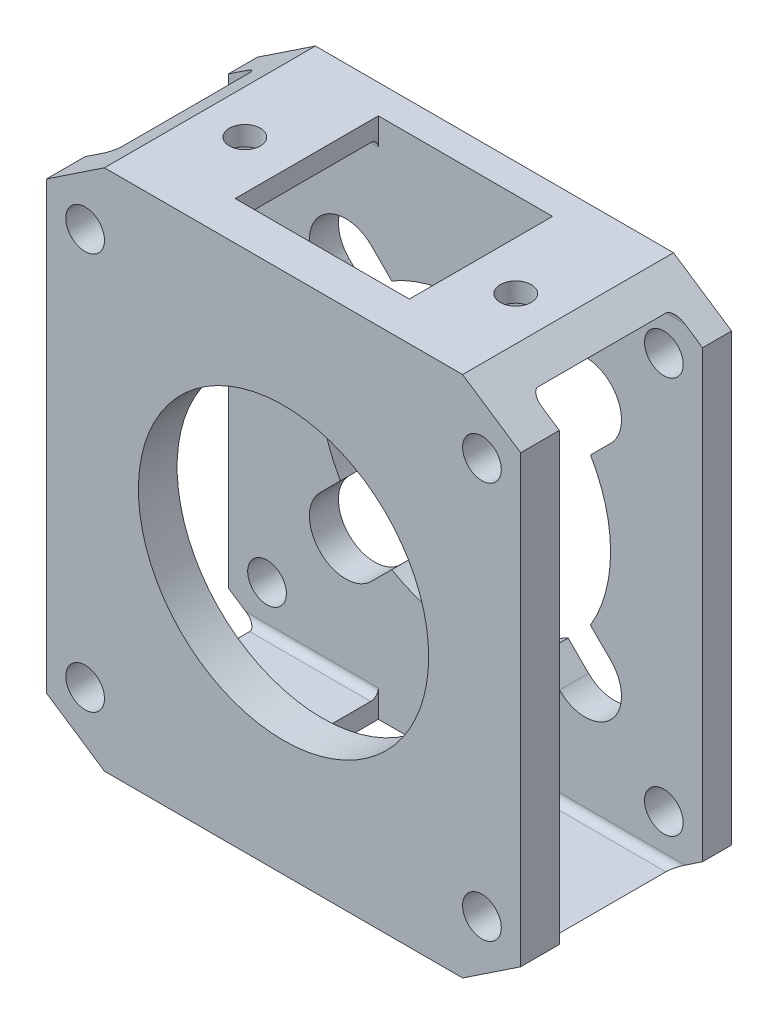
from build123d import *

# Parameters (mm, degrees)
SKETCH_1_R          = 15
SKETCH_1_R_2        = 2
EXTRUDE_1_DEPTH     = 21.8
SKETCH_2_W          = 14.8
SKETCH_2_H          = 50.012193308
CUT_EXTRUDE_1_DEPTH = 61.056343124
FILLET_1_R          = 0.8
SKETCH_3_R          = 1.6
CUT_EXTRUDE_2_DEPTH = 64.191026256
SKETCH_4_W          = 18
SKETCH_4_H          = 14.8
CUT_EXTRUDE_3_DEPTH = 64.191026256
CUT_EXTRUDE_4_DEPTH = 3


with BuildPart() as part:
    # 草图1 → 凸台-拉伸1 (new body)
    with BuildSketch(Plane.XY):
        Polygon((-24.506096654, 23.006096654), (-18.506096654, 27.006096654), (18.506096654, 27.006096654), (24.506096654, 23.006096654), (24.506096654, -23.006096654), (18.506096654, -27.006096654), (-18.506096654, -27.006096654), (-24.506096654, -23.006096654), align=None)
        Circle(SKETCH_1_R, mode=Mode.SUBTRACT)
        with Locations((-20.506096654, 20.506096654)):
            Circle(SKETCH_1_R_2, mode=Mode.SUBTRACT)
        with Locations((20.506096654, 20.506096654)):
            Circle(SKETCH_1_R_2, mode=Mode.SUBTRACT)
        with Locations((20.506096654, -20.506096654)):
            Circle(SKETCH_1_R_2, mode=Mode.SUBTRACT)
        with Locations((-20.506096654, -20.506096654)):
            Circle(SKETCH_1_R_2, mode=Mode.SUBTRACT)
    extrude(amount=EXTRUDE_1_DEPTH)

    # 草图2 → 切除-拉伸1 (cut, through all)
    with BuildSketch(Plane.ZY.offset(24.506096654)):
        with Locations((10.4, 0)):
            Rectangle(SKETCH_2_W, SKETCH_2_H)
    extrude(amount=-CUT_EXTRUDE_1_DEPTH, mode=Mode.SUBTRACT)

    # 圆角1
    fillet_1_edges = [part.edges().sort_by_distance(p)[0] for p in [
        (0, -25.006096654, 17.8),
        (0, 25.006096654, 3),
        (0, -25.006096654, 3),
        (0, 25.006096654, 17.8),
    ]]
    fillet(fillet_1_edges, radius=FILLET_1_R)

    # 草图3 → 切除-拉伸2 (cut, through all)
    with BuildSketch(Plane(origin=(0, 27.006096654, 0), x_dir=(1, 0, 0), z_dir=(0, 1, 0))):
        with Locations(Location((-14, -11.8, 0), (0, 0, 270))):
            Circle(SKETCH_3_R)
        with Locations(Location((14, -11.8, 0), (0, 0, 270))):
            Circle(SKETCH_3_R)
    extrude(amount=-CUT_EXTRUDE_2_DEPTH, mode=Mode.SUBTRACT)

    # 草图4 → 切除-拉伸3 (cut, through all)
    with BuildSketch(Plane(origin=(0, 27.006096654, 0), x_dir=(1, 0, 0), z_dir=(0, 1, 0))):
        with Locations((0, -10.4)):
            Rectangle(SKETCH_4_W, SKETCH_4_H)
    extrude(amount=-CUT_EXTRUDE_3_DEPTH, mode=Mode.SUBTRACT)

    # 草图5 → 切除-拉伸4 (cut)
    with BuildSketch(Plane(origin=(0, 0, 0), x_dir=(-1, 0, 0), z_dir=(0, 0, -1))):
        with BuildLine():
            Line((-15.0260191, 9.722718241), (-12.921448383, 7.618147524))
            ThreePointArc((-12.921448383, 7.618147524), (-10.606601718, 10.606601718), (-7.618147524, 12.921448383))
            Line((-7.618147524, 12.921448383), (-9.722718241, 15.0260191))
            ThreePointArc((-9.722718241, 15.0260191), (-15.0260191, 15.0260191), (-15.0260191, 9.722718241))
        make_face()
        with BuildLine():
            Line((15.0260191, 9.722718241), (12.921448383, 7.618147524))
            ThreePointArc((12.921448383, 7.618147524), (10.606601718, 10.606601718), (7.618147524, 12.921448383))
            Line((7.618147524, 12.921448383), (9.722718241, 15.0260191))
            ThreePointArc((9.722718241, 15.0260191), (15.0260191, 15.0260191), (15.0260191, 9.722718241))
        make_face()
        with BuildLine():
            Line((9.722718241, -15.0260191), (7.618147524, -12.921448383))
            ThreePointArc((7.618147524, -12.921448383), (10.606601718, -10.606601718), (12.921448383, -7.618147524))
            Line((12.921448383, -7.618147524), (15.0260191, -9.722718241))
            ThreePointArc((15.0260191, -9.722718241), (15.0260191, -15.0260191), (9.722718241, -15.0260191))
        make_face()
        with BuildLine():
            Line((-15.0260191, -9.722718241), (-12.921448383, -7.618147524))
            ThreePointArc((-12.921448383, -7.618147524), (-10.606601718, -10.606601718), (-7.618147524, -12.921448383))
            Line((-7.618147524, -12.921448383), (-9.722718241, -15.0260191))
            ThreePointArc((-9.722718241, -15.0260191), (-15.0260191, -15.0260191), (-15.0260191, -9.722718241))
        make_face()
    extrude(amount=-CUT_EXTRUDE_4_DEPTH, mode=Mode.SUBTRACT)


solid = part.part
